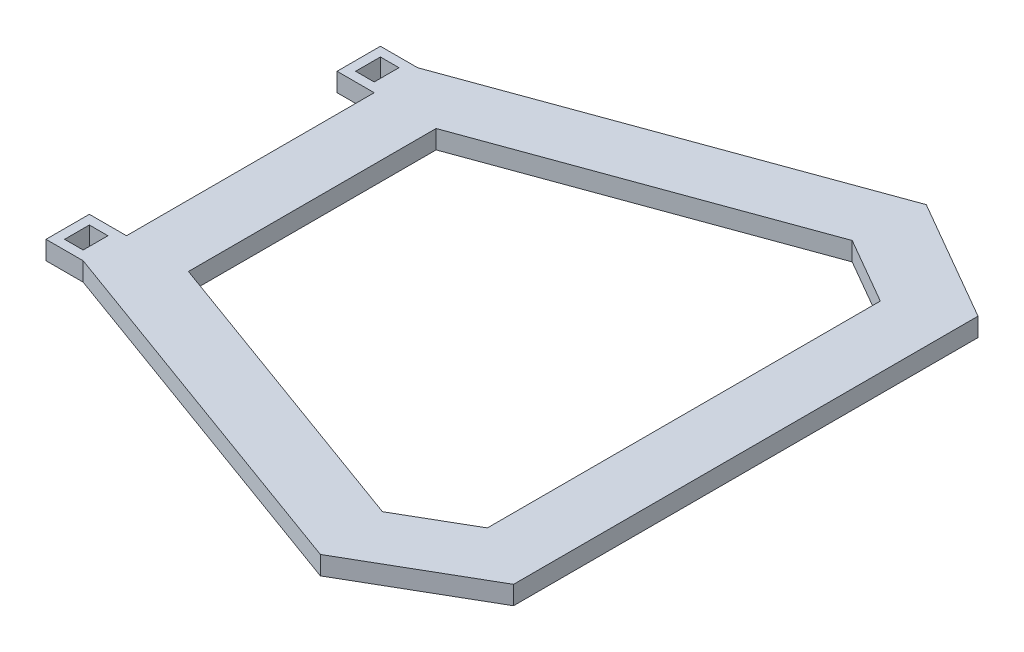
from build123d import *

# Parameters (mm, degrees)
BOSS_EXTRUDE1_DEPTH = 3
BOSS_EXTRUDE2_DEPTH = 83
CUT_EXTRUDE1_DEPTH  = 81
SKETCH8_W           = 6
SKETCH8_H           = 7
SKETCH8_W_2         = 3
SKETCH8_H_2         = 4
BOSS_EXTRUDE4_DEPTH = 3


with BuildPart() as part:
    # Sketch2 → Boss-Extrude1 (new body)
    with BuildSketch(Plane(origin=(0, 0, 0), x_dir=(0, 0, -1), z_dir=(0, -1, 0))):
        Polygon((-37.5, 0), (37.5, 0), (48.918945144, -19.778193158), (27, -80), (-27, -80), (-48.918945144, -19.778193158), align=None)
        Polygon((-31.726497308, -10), (31.726497308, -10), (37.927152815, -20.739850379), (19.997924618, -70), (-19.997924618, -70), (-37.927152815, -20.739850379), align=None, mode=Mode.SUBTRACT)
    extrude(amount=BOSS_EXTRUDE1_DEPTH)

    # Sketch8 → Boss-Extrude4 (add)
    # profile 1 of 2: a face of its own
    with BuildSketch(Plane(origin=(0, 0, 0), x_dir=(1, 0, 0), z_dir=(0, 1, 0))):
        with Locations((-83, 23.5)):
            Rectangle(SKETCH8_W, SKETCH8_H)
        with Locations((-83, 23.5)):
            Rectangle(SKETCH8_W_2, SKETCH8_H_2, mode=Mode.SUBTRACT)
    # profile 2 of 2: a face of its own
    with BuildSketch(Plane(origin=(0, 0, 0), x_dir=(1, 0, 0), z_dir=(0, 1, 0))):
        with Locations((-83, -23.5)):
            Rectangle(SKETCH8_W, SKETCH8_H)
        with Locations((-83, -23.5)):
            Rectangle(SKETCH8_W_2, SKETCH8_H_2, mode=Mode.SUBTRACT)
    extrude(amount=-BOSS_EXTRUDE4_DEPTH)


with BuildPart() as body_2:
    # Sketch3 → Boss-Extrude2 (new body)
    with BuildSketch(Plane(origin=(-95, 0, 0), x_dir=(0, -1, 0), z_dir=(-1, 0, 0))):
        Polygon((13, 27), (0, 27), (0, -27), (13, -27), (13, -24), (3, -24), (3, 24), (13, 24), align=None)
    extrude(amount=BOSS_EXTRUDE2_DEPTH)

    # Sketch4 → Cut-Extrude1 (cut)
    with BuildSketch(Plane(origin=(-178, 0, 0), x_dir=(0, -1, 0), z_dir=(-1, 0, 0))):
        Polygon((2, 27), (1, 27), (1, 25), (2, 25), (4.25, 25), (4.25, 26), (2, 26), align=None)
        Polygon((4.25, -26), (2, -26), (2, -27), (1, -27), (1, -25), (2, -25), (4.25, -25), align=None)
    extrude(amount=-CUT_EXTRUDE1_DEPTH, mode=Mode.SUBTRACT)


solid = part.part
